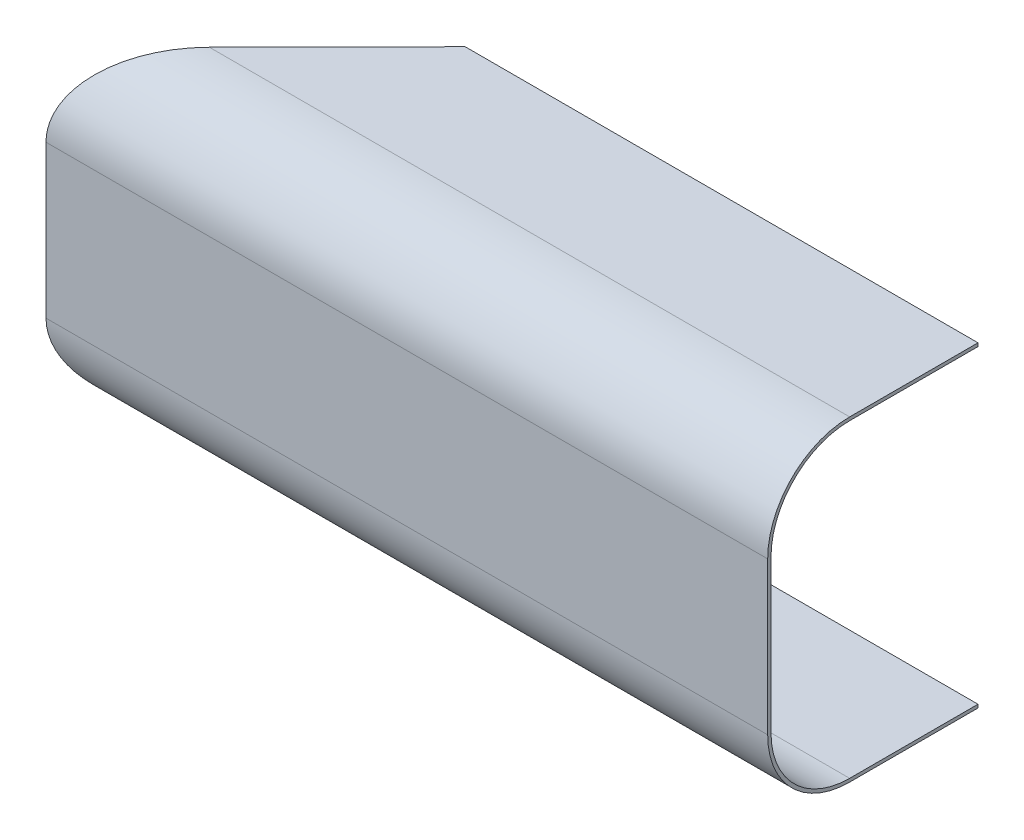
from build123d import *

# Parameters (mm, degrees)
BOSS_EXTRUDE1_DEPTH      = 196.85
BOSS_EXTRUDE1_DEPTH_BACK = 80.01
CUT_EXTRUDE1_DEPTH       = 196.85
CUT_EXTRUDE1_DEPTH_BACK  = 196.85


with BuildPart() as part:
    # Sketch1 → Boss-Extrude1 (new, two sides: drawn at the far end of the back side and taken through both)
    with BuildSketch(Plane(origin=(0, 0, -24.476668928), x_dir=(0, 0, -1), z_dir=(1, 0, 0)).offset(-BOSS_EXTRUDE1_DEPTH_BACK)):
        with BuildLine():
            Line((19.05, 118.745), (-30.1625, 118.745))
            ThreePointArc((-30.1625, 118.745), (-51.490608288, 109.910608288), (-60.325, 88.5825))
            Line((-60.325, 88.5825), (-60.325, 30.1625))
            ThreePointArc((-60.325, 30.1625), (-51.490608288, 8.834391712), (-30.1625, 0))
            Line((-30.1625, 0), (19.05, 0))
            Line((19.05, 0), (19.05, -1.27))
            Line((19.05, -1.27), (-30.1625, -1.27))
            ThreePointArc((-30.1625, -1.27), (-52.3886339, 7.9363661), (-61.595, 30.1625))
            Line((-61.595, 30.1625), (-61.595, 88.5825))
            ThreePointArc((-61.595, 88.5825), (-52.3886339, 110.8086339), (-30.1625, 120.015))
            Line((-30.1625, 120.015), (19.05, 120.015))
            Line((19.05, 120.015), (19.05, 118.745))
        make_face()
    extrude(amount=BOSS_EXTRUDE1_DEPTH + BOSS_EXTRUDE1_DEPTH_BACK)

    # Sketch2 → Cut-Extrude1 (cut, two sides: drawn at the far end of the back side and taken through both)
    with BuildSketch(Plane(origin=(0, 0, 0), x_dir=(1, 0, 0), z_dir=(0, 1, 0)).offset(-CUT_EXTRUDE1_DEPTH_BACK)):
        Polygon((0.210197293, 43.526668928), (-120.988442542, -78.530752949), (-120.988442542, 43.526668928), align=None)
    extrude(amount=CUT_EXTRUDE1_DEPTH + CUT_EXTRUDE1_DEPTH_BACK, mode=Mode.SUBTRACT)


solid = part.part
